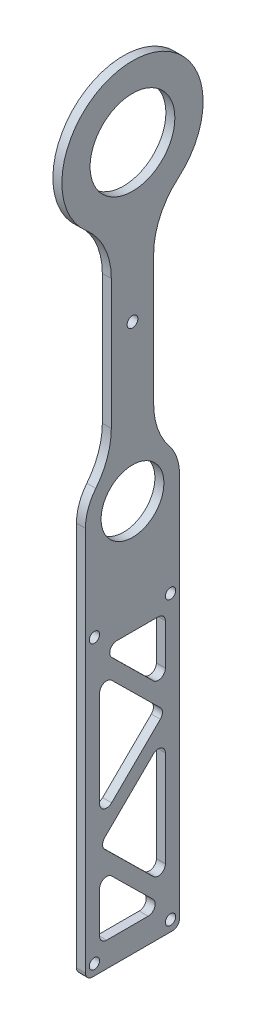
from build123d import *

# Parameters (mm, degrees)
SKETCH1_R             = 15
SKETCH1_R_2           = 1.8288
SKETCH1_R_3           = 11.1125
BOSS_EXTRUDE1_DEPTH   = 3.175
CUT_EXTRUDE1_REACH    = 173.858
SKETCH2_W             = 4.112404804
SKETCH2_H             = 127.6975
FILLET3_R             = 2.5
FILLET4_R             = 25
F_6_CLEARANCE_HOLE1_D = 3.7973


with BuildPart() as part:
    # Sketch1 → Boss-Extrude1 (new body)
    with BuildSketch(Plane(origin=(0, 0, 0), x_dir=(0, 0, -1), z_dir=(1, 0, 0))):
        with BuildLine():
            Line((20.757404804, -103.81), (20.757404804, -5))
            Line((20.757404804, -5), (16.645, 5.681808734))
            Line((16.645, 5.681808734), (16.645, 35))
            ThreePointArc((16.645, 35), (14.175569213, 43.724062271), (7.5, 49.85954323))
            Line((7.5, 49.85954323), (7.5, 121.151519965))
            ThreePointArc((7.5, 121.151519965), (0, 170), (-7.5, 121.151519965))
            Line((-7.5, 121.151519965), (-7.5, 49.85954323))
            ThreePointArc((-7.5, 49.85954323), (-14.175569213, 43.724062271), (-16.645, 35))
            Line((-16.645, 35), (-16.645, 5.681808734))
            Line((-16.645, 5.681808734), (-20.757404804, -5))
            Line((-20.757404804, -5), (-20.757404804, -103.81))
            Line((-20.757404804, -103.81), (20.757404804, -103.81))
        make_face()
        with Locations((0, 145)):
            Circle(SKETCH1_R, mode=Mode.SUBTRACT)
        with Locations((-13.4747, -100)):
            Circle(SKETCH1_R_2, mode=Mode.SUBTRACT)
        with Locations((13.4747, -100)):
            Circle(SKETCH1_R_2, mode=Mode.SUBTRACT)
        with Locations((-13.4747, 0)):
            Circle(SKETCH1_R_2, mode=Mode.SUBTRACT)
        with Locations((13.4747, 0)):
            Circle(SKETCH1_R_2, mode=Mode.SUBTRACT)
        with Locations((0, 35)):
            Circle(SKETCH1_R_3, mode=Mode.SUBTRACT)
    extrude(amount=BOSS_EXTRUDE1_DEPTH)

    # Sketch2 → Cut-Extrude1 (cut, up to next)
    with BuildSketch(Plane(origin=(3.175, 0, 0), x_dir=(0, 0, -1), z_dir=(1, 0, 0)), mode=Mode.PRIVATE) as cut_extrude1_sk1:
        Polygon((11.645, -5), (-11.645, -5), (11.645, -27.976379872), align=None)
    cut_extrude1_tool1 = extrude(cut_extrude1_sk1.sketch, amount=-CUT_EXTRUDE1_REACH, mode=Mode.PRIVATE) & part.part
    # Sketch2 → Cut-Extrude1 (cut, up to next)
    with BuildSketch(Plane(origin=(3.175, 0, 0), x_dir=(0, 0, -1), z_dir=(1, 0, 0)), mode=Mode.PRIVATE) as cut_extrude1_sk2:
        Polygon((-11.645, -12.023620128), (11.645, -35), (-11.645, -57.976379872), (-11.645, -35), align=None)
    cut_extrude1_tool2 = extrude(cut_extrude1_sk2.sketch, amount=-CUT_EXTRUDE1_REACH, mode=Mode.PRIVATE) & part.part
    # Sketch2 → Cut-Extrude1 (cut, up to next)
    with BuildSketch(Plane(origin=(3.175, 0, 0), x_dir=(0, 0, -1), z_dir=(1, 0, 0)), mode=Mode.PRIVATE) as cut_extrude1_sk3:
        Polygon((-11.645, -72.023620128), (-11.645, -95), (11.645, -95), align=None)
    cut_extrude1_tool3 = extrude(cut_extrude1_sk3.sketch, amount=-CUT_EXTRUDE1_REACH, mode=Mode.PRIVATE) & part.part
    # Sketch2 → Cut-Extrude1 (cut, up to next)
    with BuildSketch(Plane(origin=(3.175, 0, 0), x_dir=(0, 0, -1), z_dir=(1, 0, 0)), mode=Mode.PRIVATE) as cut_extrude1_sk4:
        Polygon((11.645, -42.023620128), (11.645, -65), (11.645, -87.976379872), (-11.645, -65), align=None)
    cut_extrude1_tool4 = extrude(cut_extrude1_sk4.sketch, amount=-CUT_EXTRUDE1_REACH, mode=Mode.PRIVATE) & part.part
    # Sketch2 → Cut-Extrude1 (cut, up to next)
    with BuildSketch(Plane(origin=(3.175, 0, 0), x_dir=(0, 0, -1), z_dir=(1, 0, 0)), mode=Mode.PRIVATE) as cut_extrude1_sk5:
        with Locations((-18.701202402, -39.96125)):
            Rectangle(SKETCH2_W, SKETCH2_H)
    cut_extrude1_tool5 = extrude(cut_extrude1_sk5.sketch, amount=-CUT_EXTRUDE1_REACH, mode=Mode.PRIVATE) & part.part
    # Sketch2 → Cut-Extrude1 (cut, up to next)
    with BuildSketch(Plane(origin=(3.175, 0, 0), x_dir=(0, 0, -1), z_dir=(1, 0, 0)), mode=Mode.PRIVATE) as cut_extrude1_sk6:
        with Locations((18.701202402, -39.96125)):
            Rectangle(SKETCH2_W, SKETCH2_H)
    cut_extrude1_tool6 = extrude(cut_extrude1_sk6.sketch, amount=-CUT_EXTRUDE1_REACH, mode=Mode.PRIVATE) & part.part
    add(cut_extrude1_tool1.solids().sort_by_distance((3.175, -12.658793, -3.881667))[0], mode=Mode.SUBTRACT)
    add(cut_extrude1_tool2.solids().sort_by_distance((3.175, -35, 3.881667))[0], mode=Mode.SUBTRACT)
    add(cut_extrude1_tool3.solids().sort_by_distance((3.175, -87.341207, 3.881667))[0], mode=Mode.SUBTRACT)
    add(cut_extrude1_tool4.solids().sort_by_distance((3.175, -65, -3.881667))[0], mode=Mode.SUBTRACT)
    add(cut_extrude1_tool5.solids().sort_by_distance((3.175, -39.96125, 18.701202))[0], mode=Mode.SUBTRACT)
    add(cut_extrude1_tool6.solids().sort_by_distance((3.175, -39.96125, -18.701202))[0], mode=Mode.SUBTRACT)

    # Fillet3
    fillet3_edges = [part.edges().sort_by_distance(p)[0] for p in [
        (1.5875, -103.81, 16.645),
        (1.5875, -12.023620128, 11.645),
        (1.5875, -35, -11.645),
        (1.5875, -57.976379872, 11.645),
        (1.5875, -103.81, -16.645),
        (1.5875, -72.023620128, 11.645),
        (1.5875, -95, -11.645),
        (1.5875, -95, 11.645),
        (1.5875, -87.976379872, -11.645),
        (1.5875, -65, 11.645),
        (1.5875, -42.023620128, -11.645),
        (1.5875, -27.976379872, -11.645),
        (1.5875, -5, 11.645),
        (1.5875, -5, -11.645),
    ]]
    fillet(fillet3_edges, radius=FILLET3_R)

    # Fillet4
    fillet4_edges = [part.edges().sort_by_distance(p)[0] for p in [
        (1.5875, 49.85954323, 7.5),
        (1.5875, 121.151519965, 7.5),
        (1.5875, 121.151519965, -7.5),
        (1.5875, 49.85954323, -7.5),
    ]]
    fillet(fillet4_edges, radius=FILLET4_R)

    # #6 Clearance Hole1 (through all)
    with Locations(Plane(origin=(3.175, 0, 0), x_dir=(0, 0, -1), z_dir=(1, 0, 0))):
        with Locations((0, 90)):
            Hole(F_6_CLEARANCE_HOLE1_D / 2)


solid = part.part
